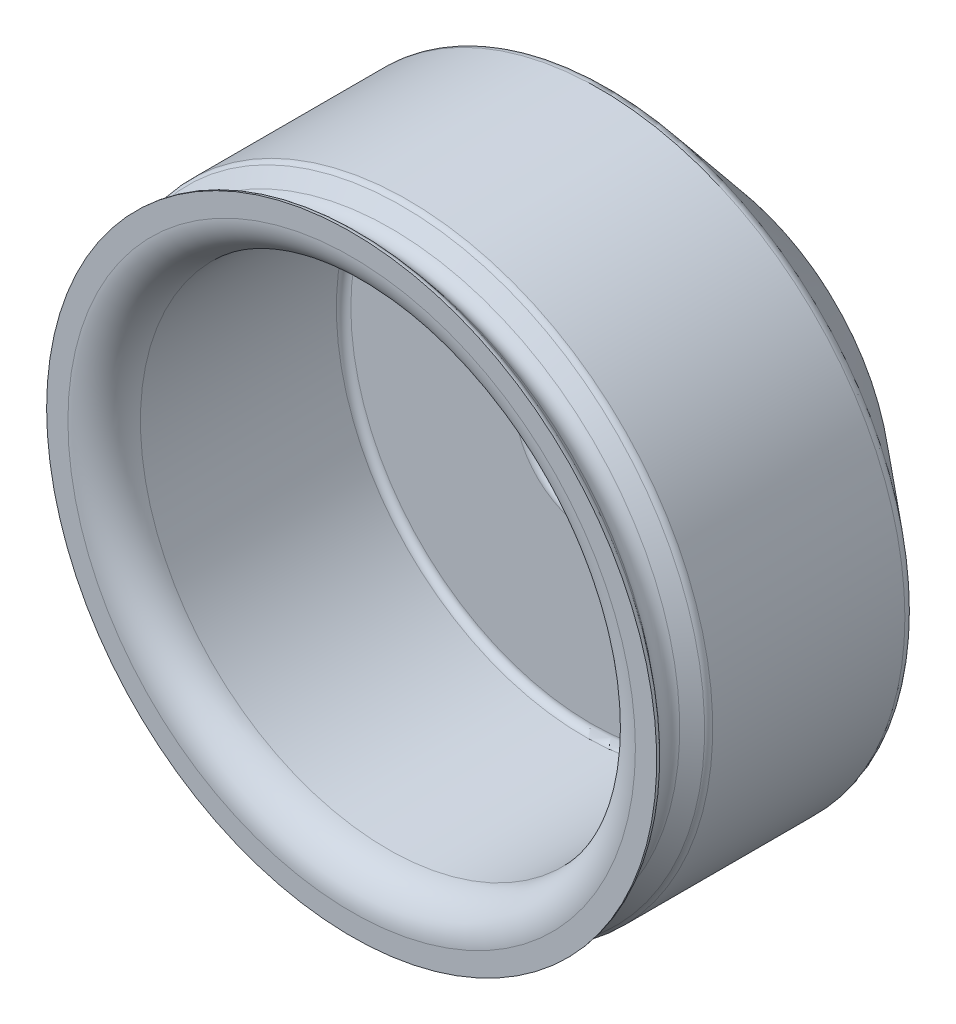
from build123d import *

# Parameters (mm, degrees)
SKETCH1_R           = 13.6525
BOSS_EXTRUDE1_DEPTH = 3.175
SKETCH2_R           = 13.6525
SKETCH2_R_2         = 3.81
BOSS_EXTRUDE2_DEPTH = 3.175
FILLET1_R           = 0.4
FILLET3_R           = 2
FILLET6_R           = 0.6


with BuildPart() as part:
    # Sketch1 → Boss-Extrude1 (new body)
    with BuildSketch(Plane.XY):
        Circle(SKETCH1_R)
        with BuildLine():
            Line((-1.618440484, 1.4859), (1.618440484, 1.4859))
            ThreePointArc((1.618440484, 1.4859), (0, -2.1971), (-1.618440484, 1.4859))
        make_face(mode=Mode.SUBTRACT)
    extrude(amount=BOSS_EXTRUDE1_DEPTH)

    # Sketch2 → Boss-Extrude2 (add)
    with BuildSketch(Plane.XY.offset(3.175)):
        Circle(SKETCH2_R)
        Circle(SKETCH2_R_2, mode=Mode.SUBTRACT)
    extrude(amount=BOSS_EXTRUDE2_DEPTH)

    # Sketch5 → Revolve1 (revolve)
    with BuildSketch(Plane(origin=(0, 0, 0), x_dir=(0, 0, -1), z_dir=(1, 0, 0)), mode=Mode.PRIVATE) as revolve1_sk:
        with BuildLine():
            Line((0, 13.6525), (-19.558, 13.6525))
            Line((-19.558, 13.6525), (-19.558, 16.8275))
            ThreePointArc((-19.558, 16.8275), (-19.388952695, 16.790023115), (-19.251582223, 16.684615044))
            Line((-19.251582223, 16.684615044), (-18.625324298, 15.938269912))
            ThreePointArc((-18.625324298, 15.938269912), (-18.012488744, 15.6525), (-17.399653189, 15.938269912))
            Line((-17.399653189, 15.938269912), (-16.773395264, 16.684615044))
            ThreePointArc((-16.773395264, 16.684615044), (-16.636024792, 16.790023115), (-16.466977487, 16.8275))
            Line((-16.466977487, 16.8275), (0, 16.8275))
            Line((0, 16.8275), (0, 13.6525))
        make_face()
    revolve(revolve1_sk.sketch.rotate(Axis((0, 0, 0), (0, 0, 1)), 90), axis=Axis((0, 0, 0), (0, 0, 1)))

    # Fillet1
    fillet1_edges = [part.edges().sort_by_distance(p)[0] for p in [
        (-3.81, 0, 3.175),
        (-3.81, 0, 6.35),
        (13.6525, 0, 6.35),
        (0, -2.1971, 3.175),
        (0, 1.4859, 3.175),
    ]]
    fillet(fillet1_edges, radius=FILLET1_R)

    # Sketch7 → Cut-Revolve1 (revolve, cut)
    with BuildSketch(Plane(origin=(0, 0, 0), x_dir=(1, 0, 0), z_dir=(0, 1, 0))):
        Polygon((-16.8275, -5.588), (-10.167980925, 0), (-16.8275, 0), align=None)
    revolve(axis=Axis((0, 0, 0), (0, 0, 1)), mode=Mode.SUBTRACT)

    # Fillet3
    fillet3_edges = [part.edges().sort_by_distance(p)[0] for p in [
        (13.6525, 0, 19.558),
    ]]
    fillet(fillet3_edges, radius=FILLET3_R)

    # Fillet6
    fillet6_edges = [part.edges().sort_by_distance(p)[0] for p in [
        (16.8275, 0, 5.588),
        (10.167980925, 0, 0),
        (0, -2.1971, 0),
        (0, 1.4859, 0),
    ]]
    fillet(fillet6_edges, radius=FILLET6_R)


solid = part.part
